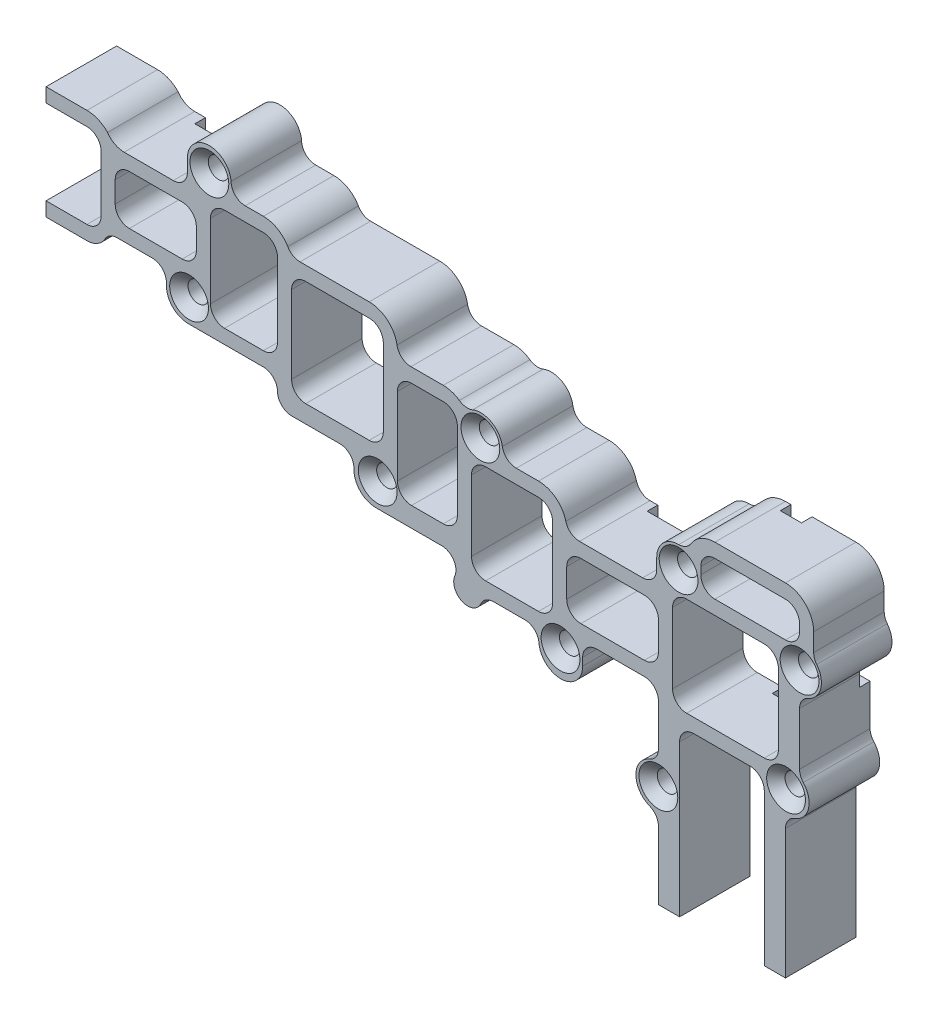
from build123d import *

# Parameters (mm, degrees)
EXTRUDE_1_DEPTH                 = 10
HOLE_WIZARD_M2_51_D             = 2.9
HOLE_WIZARD_M2_51_CSINK_D       = 5.5
HOLE_WIZARD_M2_51_CSINK_ANGLE   = 90
CUT_EXTRUDE_1_REACH             = 117.174
SKETCH_9_W                      = 1.5
SKETCH_9_H                      = 1.8
CUT_EXTRUDE_2_REACH             = 105.395
SKETCH_10_W                     = 1.5
SKETCH_10_H                     = 2.8
CUT_EXTRUDE_3_REACH             = 95.728
SKETCH_11_W                     = 1.5
SKETCH_11_H                     = 4.61050078
CUT_EXTRUDE_5_REACH             = 116.534
SKETCH_12_W                     = 5.79500384
SKETCH_12_H                     = 1.5
CUT_EXTRUDE_6_REACH             = 83.835
SKETCH_13_W                     = 1.5
SKETCH_13_H                     = 5.238699812
CUT_EXTRUDE_6_DIRECTION_2_REACH = 83.835
CUT_EXTRUDE_7_REACH             = 80.99
SKETCH_14_W                     = 1.5
SKETCH_14_H                     = 5.29970024
CUT_EXTRUDE_8_REACH             = 91.419
SKETCH_15_W                     = 1.5
SKETCH_15_H                     = 1.85499896
CUT_EXTRUDE_9_REACH             = 103.857
SKETCH_17_W                     = 1.5
SKETCH_17_H                     = 2.8
CUT_EXTRUDE_10_REACH            = 110.308
SKETCH_18_W                     = 5.78751592
SKETCH_18_H                     = 1.5
CUT_EXTRUDE_11_REACH            = 111.188
SKETCH_19_W                     = 1.80000034
SKETCH_19_H                     = 1.5
CUT_EXTRUDE_12_REACH            = 113.91
SKETCH_20_W                     = 3.00000054
SKETCH_20_H                     = 1.5
CUT_EXTRUDE_13_REACH            = 118.683
SKETCH_21_W                     = 1.5
SKETCH_21_H                     = 2.3400024
CUT_EXTRUDE_14_REACH            = 110.602
SKETCH_22_W                     = 2.8
SKETCH_22_H                     = 1.5


with BuildPart() as part:
    # Эскиз6 → Бобышка-Вытянуть1 (new body)
    with BuildSketch(Plane.XY):
        with BuildLine():
            Line((81.20000086, -9.00000176), (81.20000086, 12.49999824))
            ThreePointArc((81.20000086, 12.49999824), (81.785787298, 13.914211802), (83.20000086, 14.49999824))
            Line((83.20000086, 14.49999824), (91.20000086, 14.49999824))
            ThreePointArc((91.20000086, 14.49999824), (92.614214422, 13.914211802), (93.20000086, 12.49999824))
            Line((93.20000086, 12.49999824), (93.20000086, -9.00000176))
            Line((93.20000086, -9.00000176), (96.20000086, -9.00000176))
            Line((96.20000086, -9.00000176), (96.20000086, 9.366820625))
            ThreePointArc((96.20000086, 9.366820625), (96.561747801, 10.514046373), (97.516127776, 11.246266715))
            ThreePointArc((97.516127776, 11.246266715), (99.468975957, 13.429527292), (98.731814051, 16.264458523))
            ThreePointArc((98.731814051, 16.264458523), (98.337694008, 16.893300305), (98.20000086, 17.622555535))
            Line((98.20000086, 17.622555535), (98.20000086, 25.088270618))
            ThreePointArc((98.20000086, 25.088270618), (98.531374561, 26.190852259), (99.415687135, 26.928067341))
            ThreePointArc((99.415687135, 26.928067341), (101.204160141, 29.014881672), (100.631373409, 31.702881879))
            ThreePointArc((100.631373409, 31.702881879), (100.310919747, 32.286821087), (100.20000086, 32.943610664))
            Line((100.20000086, 32.943610664), (100.20000086, 35.49999824))
            ThreePointArc((100.20000086, 35.49999824), (99.028427985, 38.328425365), (96.20000086, 39.49999824))
            Line((96.20000086, 39.49999824), (86.20000086, 39.49999824))
            ThreePointArc((86.20000086, 39.49999824), (84.24736537, 38.991017381), (82.791656925, 37.593605562))
            ThreePointArc((82.791656925, 37.593605562), (82.058610903, 36.892005839), (81.075597393, 36.640444553))
            ThreePointArc((81.075597393, 36.640444553), (78.871664833, 35.73903516), (77.957171668, 33.540499312))
            Line((77.957171668, 33.540499312), (77.957171668, 31.99999824))
            ThreePointArc((77.957171668, 31.99999824), (77.37138523, 30.585784678), (75.957171668, 29.99999824))
            Line((75.957171668, 29.99999824), (67.009475879, 29.99999824))
            ThreePointArc((67.009475879, 29.99999824), (65.784731008, 30.41885941), (65.072984206, 31.49999824))
            ThreePointArc((65.072984206, 31.49999824), (63.649490603, 33.6622759), (61.20000086, 34.49999824))
            Line((61.20000086, 34.49999824), (58.049746648, 34.49999824))
            ThreePointArc((58.049746648, 34.49999824), (56.752186507, 34.978046309), (56.074922485, 36.183660559))
            ThreePointArc((56.074922485, 36.183660559), (54.543128866, 38.389927001), (51.863412539, 38.571926213))
            ThreePointArc((51.863412539, 38.571926213), (50.895117619, 38.441892277), (49.98075596, 38.786053044))
            ThreePointArc((49.98075596, 38.786053044), (48.894944537, 39.317341506), (47.70000086, 39.49999824))
            Line((47.70000086, 39.49999824), (43.116080643, 39.49999824))
            ThreePointArc((43.116080643, 39.49999824), (41.825086194, 39.972473008), (41.144054049, 41.166664907))
            ThreePointArc((41.144054049, 41.166664907), (39.781989757, 43.555048703), (37.20000086, 44.49999824))
            Line((37.20000086, 44.49999824), (27.396153283, 44.49999824))
            ThreePointArc((27.396153283, 44.49999824), (26.396153283, 44.767947432), (25.664102475, 45.49999824))
            ThreePointArc((25.664102475, 45.49999824), (24.20000086, 46.964099855), (22.20000086, 47.49999824))
            Line((22.20000086, 47.49999824), (19.622055186, 47.49999824))
            ThreePointArc((19.622055186, 47.49999824), (18.208125612, 48.085500746), (17.622055347, 49.49919508))
            ThreePointArc((17.622055347, 49.49919508), (14.407643171, 52.348107474), (11.432038739, 49.250604328))
            Line((11.432038739, 49.250604328), (11.432038739, 47.49999824))
            ThreePointArc((11.432038739, 47.49999824), (10.846252302, 46.085784678), (9.432038739, 45.49999824))
            Line((9.432038739, 45.49999824), (2.472362834, 45.49999824))
            ThreePointArc((2.472362834, 45.49999824), (1.133134911, 45.83192166), (0.10392771, 46.750854261))
            ThreePointArc((0.10392771, 46.750854261), (-1.219401798, 47.674465826), (-2.79999914, 47.99999824))
            Line((-2.79999914, 47.99999824), (-8.59999914, 47.99999824))
            Line((-8.59999914, 47.99999824), (-8.59999914, 45.99999824))
            Line((-8.59999914, 45.99999824), (-2.79999914, 45.99999824))
            ThreePointArc((-2.79999914, 45.99999824), (-1.385785578, 45.414211802), (-0.79999914, 43.99999824))
            Line((-0.79999914, 43.99999824), (-0.79999914, 35.99999824))
            ThreePointArc((-0.79999914, 35.99999824), (-1.385785578, 34.585784678), (-2.79999914, 33.99999824))
            Line((-2.79999914, 33.99999824), (-8.59999914, 33.99999824))
            Line((-8.59999914, 33.99999824), (-8.59999914, 31.99999824))
            Line((-8.59999914, 31.99999824), (-2.79999914, 31.99999824))
            ThreePointArc((-2.79999914, 31.99999824), (-1.32231541, 32.398875435), (-0.246063762, 33.487146823))
            ThreePointArc((-0.246063762, 33.487146823), (0.486938319, 34.228335181), (1.493343515, 34.49999824))
            Line((1.493343515, 34.49999824), (6.460860195, 34.49999824))
            ThreePointArc((6.460860195, 34.49999824), (7.875073757, 33.914211802), (8.460860195, 32.49999824))
            Line((8.460860195, 32.49999824), (8.460860195, 32.09999824))
            ThreePointArc((8.460860195, 32.09999824), (9.368829173, 29.907967218), (11.560860195, 28.99999824))
            Line((11.560860195, 28.99999824), (22.20000086, 28.99999824))
            ThreePointArc((22.20000086, 28.99999824), (23.614214422, 28.414211802), (24.20000086, 26.99999824))
            ThreePointArc((24.20000086, 26.99999824), (24.785787298, 25.585784678), (26.20000086, 24.99999824))
            Line((26.20000086, 24.99999824), (33.041851282, 24.99999824))
            ThreePointArc((33.041851282, 24.99999824), (34.456064844, 24.414211802), (35.041851282, 22.99999824))
            Line((35.041851282, 22.99999824), (35.041851282, 22.79999824))
            ThreePointArc((35.041851282, 22.79999824), (35.94982026, 20.607967218), (38.141851282, 19.69999824))
            Line((38.141851282, 19.69999824), (47.495717397, 19.69999824))
            ThreePointArc((47.495717397, 19.69999824), (49.163112902, 18.804440284), (49.337259097, 16.919790469))
            ThreePointArc((49.337259097, 16.919790469), (50.378754158, 14.306572776), (53.003065225, 15.319790469))
            ThreePointArc((53.003065225, 15.319790469), (53.740955973, 16.179221938), (54.827329652, 16.49999824))
            Line((54.827329652, 16.49999824), (59.273091273, 16.49999824))
            ThreePointArc((59.273091273, 16.49999824), (60.630713184, 15.968624382), (61.266930303, 14.656860985))
            ThreePointArc((61.266930303, 14.656860985), (64.479043159, 11.802386536), (67.4573808, 14.89999824))
            Line((67.4573808, 14.89999824), (67.4573808, 15.99999824))
            ThreePointArc((67.4573808, 15.99999824), (68.043167238, 17.414211802), (69.4573808, 17.99999824))
            Line((69.4573808, 17.99999824), (76.20000086, 17.99999824))
            ThreePointArc((76.20000086, 17.99999824), (77.614214422, 17.414211802), (78.20000086, 15.99999824))
            Line((78.20000086, 15.99999824), (78.20000086, 10.096040906))
            ThreePointArc((78.20000086, 10.096040906), (77.856834599, 8.975816838), (76.945098899, 8.240015876))
            ThreePointArc((76.945098899, 8.240015876), (75.00000086, 5.363177079), (76.945098899, 2.486338283))
            ThreePointArc((76.945098899, 2.486338283), (77.856834599, 1.75053732), (78.20000086, 0.630313253))
            Line((78.20000086, 0.630313253), (78.20000086, -9.00000176))
            Line((78.20000086, -9.00000176), (81.20000086, -9.00000176))
        make_face()
        with BuildLine():
            Line((3.20000086, 43.49999824), (10.70000086, 43.49999824))
            ThreePointArc((10.70000086, 43.49999824), (12.114214422, 42.914211802), (12.70000086, 41.49999824))
            Line((12.70000086, 41.49999824), (12.70000086, 38.49999824))
            ThreePointArc((12.70000086, 38.49999824), (12.114214422, 37.085784678), (10.70000086, 36.49999824))
            Line((10.70000086, 36.49999824), (3.20000086, 36.49999824))
            ThreePointArc((3.20000086, 36.49999824), (1.785787298, 37.085784678), (1.20000086, 38.49999824))
            Line((1.20000086, 38.49999824), (1.20000086, 41.49999824))
            ThreePointArc((1.20000086, 41.49999824), (1.785787298, 42.914211802), (3.20000086, 43.49999824))
        make_face(mode=Mode.SUBTRACT)
        with BuildLine():
            Line((82.20000086, 30.49999824), (93.20000086, 30.49999824))
            ThreePointArc((93.20000086, 30.49999824), (94.614214422, 29.914211802), (95.20000086, 28.49999824))
            Line((95.20000086, 28.49999824), (95.20000086, 18.49999824))
            ThreePointArc((95.20000086, 18.49999824), (94.614214422, 17.085784678), (93.20000086, 16.49999824))
            Line((93.20000086, 16.49999824), (82.20000086, 16.49999824))
            ThreePointArc((82.20000086, 16.49999824), (80.785787298, 17.085784678), (80.20000086, 18.49999824))
            Line((80.20000086, 18.49999824), (80.20000086, 28.49999824))
            ThreePointArc((80.20000086, 28.49999824), (80.785787298, 29.914211802), (82.20000086, 30.49999824))
        make_face(mode=Mode.SUBTRACT)
        with BuildLine():
            Line((86.20000086, 37.49999824), (96.20000086, 37.49999824))
            ThreePointArc((96.20000086, 37.49999824), (97.614214422, 36.914211802), (98.20000086, 35.49999824))
            Line((98.20000086, 35.49999824), (98.20000086, 34.49999824))
            ThreePointArc((98.20000086, 34.49999824), (97.614214422, 33.085784678), (96.20000086, 32.49999824))
            Line((96.20000086, 32.49999824), (86.20000086, 32.49999824))
            ThreePointArc((86.20000086, 32.49999824), (84.785787298, 33.085784678), (84.20000086, 34.49999824))
            Line((84.20000086, 34.49999824), (84.20000086, 35.49999824))
            ThreePointArc((84.20000086, 35.49999824), (84.785787298, 36.914211802), (86.20000086, 37.49999824))
        make_face(mode=Mode.SUBTRACT)
        with BuildLine():
            Line((67.20000086, 27.99999824), (76.20000086, 27.99999824))
            ThreePointArc((76.20000086, 27.99999824), (77.614214422, 27.414211802), (78.20000086, 25.99999824))
            Line((78.20000086, 25.99999824), (78.20000086, 21.99999824))
            ThreePointArc((78.20000086, 21.99999824), (77.614214422, 20.585784678), (76.20000086, 19.99999824))
            Line((76.20000086, 19.99999824), (67.20000086, 19.99999824))
            ThreePointArc((67.20000086, 19.99999824), (65.785787298, 20.585784678), (65.20000086, 21.99999824))
            Line((65.20000086, 21.99999824), (65.20000086, 25.99999824))
            ThreePointArc((65.20000086, 25.99999824), (65.785787298, 27.414211802), (67.20000086, 27.99999824))
        make_face(mode=Mode.SUBTRACT)
        with BuildLine():
            Line((61.20000086, 32.49999824), (53.70000086, 32.49999824))
            ThreePointArc((53.70000086, 32.49999824), (52.285787298, 31.914211802), (51.70000086, 30.49999824))
            Line((51.70000086, 30.49999824), (51.70000086, 20.49999824))
            ThreePointArc((51.70000086, 20.49999824), (52.285787298, 19.085784678), (53.70000086, 18.49999824))
            Line((53.70000086, 18.49999824), (61.20000086, 18.49999824))
            ThreePointArc((61.20000086, 18.49999824), (62.614214422, 19.085784678), (63.20000086, 20.49999824))
            Line((63.20000086, 20.49999824), (63.20000086, 30.49999824))
            ThreePointArc((63.20000086, 30.49999824), (62.614214422, 31.914211802), (61.20000086, 32.49999824))
        make_face(mode=Mode.SUBTRACT)
        with BuildLine():
            Line((43.20000086, 37.49999824), (47.70000086, 37.49999824))
            ThreePointArc((47.70000086, 37.49999824), (49.114214422, 36.914211802), (49.70000086, 35.49999824))
            Line((49.70000086, 35.49999824), (49.70000086, 24.49999824))
            ThreePointArc((49.70000086, 24.49999824), (49.114214422, 23.085784678), (47.70000086, 22.49999824))
            Line((47.70000086, 22.49999824), (43.20000086, 22.49999824))
            ThreePointArc((43.20000086, 22.49999824), (41.785787298, 23.085784678), (41.20000086, 24.49999824))
            Line((41.20000086, 24.49999824), (41.20000086, 35.49999824))
            ThreePointArc((41.20000086, 35.49999824), (41.785787298, 36.914211802), (43.20000086, 37.49999824))
        make_face(mode=Mode.SUBTRACT)
        with BuildLine():
            Line((28.20000086, 42.49999824), (37.20000086, 42.49999824))
            ThreePointArc((37.20000086, 42.49999824), (38.614214422, 41.914211802), (39.20000086, 40.49999824))
            Line((39.20000086, 40.49999824), (39.20000086, 29.49999824))
            ThreePointArc((39.20000086, 29.49999824), (38.614214422, 28.085784678), (37.20000086, 27.49999824))
            Line((37.20000086, 27.49999824), (28.20000086, 27.49999824))
            ThreePointArc((28.20000086, 27.49999824), (26.785787298, 28.085784678), (26.20000086, 29.49999824))
            Line((26.20000086, 29.49999824), (26.20000086, 40.49999824))
            ThreePointArc((26.20000086, 40.49999824), (26.785787298, 41.914211802), (28.20000086, 42.49999824))
        make_face(mode=Mode.SUBTRACT)
        with BuildLine():
            Line((16.70000086, 45.49999824), (22.20000086, 45.49999824))
            ThreePointArc((22.20000086, 45.49999824), (23.614214422, 44.914211802), (24.20000086, 43.49999824))
            Line((24.20000086, 43.49999824), (24.20000086, 32.99999824))
            ThreePointArc((24.20000086, 32.99999824), (23.614214422, 31.585784678), (22.20000086, 30.99999824))
            Line((22.20000086, 30.99999824), (16.70000086, 30.99999824))
            ThreePointArc((16.70000086, 30.99999824), (15.285787298, 31.585784678), (14.70000086, 32.99999824))
            Line((14.70000086, 32.99999824), (14.70000086, 43.49999824))
            ThreePointArc((14.70000086, 43.49999824), (15.285787298, 44.914211802), (16.70000086, 45.49999824))
        make_face(mode=Mode.SUBTRACT)
    extrude(amount=EXTRUDE_1_DEPTH)

    # Отверстие с зазором M2.51 (through all)
    with Locations(Plane.XY.offset(10)):
        with Locations((14.552676738, 48.9918182), (11.673412415, 32.307135082), (38.407901683, 23.093297034), (64.315400785, 15.510970613), (78.189738908, 5.49892165), (96.282490093, 14.234813878), (98.20000086, 29.779752261), (81.057171668, 33.540499312), (52.959520703, 35.665984683)):
            CounterSinkHole(HOLE_WIZARD_M2_51_D / 2, HOLE_WIZARD_M2_51_CSINK_D / 2, counter_sink_angle=HOLE_WIZARD_M2_51_CSINK_ANGLE)

    # Эскиз9 → Вырез-Вытянуть1 (cut, up to next)
    with BuildSketch(Plane.ZY.offset(0.79999914), mode=Mode.PRIVATE) as cut_extrude_1_sk1:
        with Locations((0.75, 39.99999824)):
            Rectangle(SKETCH_9_W, SKETCH_9_H)
    cut_extrude_1_tool1 = extrude(cut_extrude_1_sk1.sketch, amount=-CUT_EXTRUDE_1_REACH, mode=Mode.PRIVATE) & part.part
    add(cut_extrude_1_tool1.solids().sort_by_distance((-0.799999, 39.999998, 0.75))[0], mode=Mode.SUBTRACT)

    # Эскиз10 → Вырез-Вытянуть2 (cut, up to next)
    with BuildSketch(Plane.ZY.offset(-12.70000086), mode=Mode.PRIVATE) as cut_extrude_2_sk1:
        with Locations((0.75, 39.97126499)):
            Rectangle(SKETCH_10_W, SKETCH_10_H)
    cut_extrude_2_tool1 = extrude(cut_extrude_2_sk1.sketch, amount=-CUT_EXTRUDE_2_REACH, mode=Mode.PRIVATE) & part.part
    add(cut_extrude_2_tool1.solids().sort_by_distance((12.700001, 39.971265, 0.75))[0], mode=Mode.SUBTRACT)

    # Эскиз11 → Вырез-Вытянуть3 (cut, up to next)
    with BuildSketch(Plane.ZY.offset(-24.20000086), mode=Mode.PRIVATE) as cut_extrude_3_sk1:
        with Locations((0.75, 36.83914781)):
            Rectangle(SKETCH_11_W, SKETCH_11_H)
    cut_extrude_3_tool1 = extrude(cut_extrude_3_sk1.sketch, amount=-CUT_EXTRUDE_3_REACH, mode=Mode.PRIVATE) & part.part
    add(cut_extrude_3_tool1.solids().sort_by_distance((24.200001, 36.839148, 0.75))[0], mode=Mode.SUBTRACT)

    # Эскиз12 → Вырез-Вытянуть5 (cut, up to next)
    with BuildSketch(Plane.XZ.offset(-43.49999824), mode=Mode.PRIVATE) as cut_extrude_5_sk1:
        with Locations((6.88750972, 0.75)):
            Rectangle(SKETCH_12_W, SKETCH_12_H)
    cut_extrude_5_tool1 = extrude(cut_extrude_5_sk1.sketch, amount=-CUT_EXTRUDE_5_REACH, mode=Mode.PRIVATE) & part.part
    add(cut_extrude_5_tool1.solids().sort_by_distance((6.88751, 43.499998, 0.75))[0], mode=Mode.SUBTRACT)

    # Эскиз13 → Вырез-Вытянуть6 (cut, up to next)
    with BuildSketch(Plane.ZY.offset(-39.20000086), mode=Mode.PRIVATE) as cut_extrude_6_sk1:
        with Locations((0.75, 31.850348174)):
            Rectangle(SKETCH_13_W, SKETCH_13_H)
    cut_extrude_6_tool1 = extrude(cut_extrude_6_sk1.sketch, amount=-CUT_EXTRUDE_6_REACH, mode=Mode.PRIVATE) & part.part
    add(cut_extrude_6_tool1.solids().sort_by_distance((39.200001, 31.850348, 0.75))[0], mode=Mode.SUBTRACT)

    # Эскиз13 → Вырез-Вытянуть6 direction 2 (cut, up to next)
    with BuildSketch(Plane.ZY.offset(-39.20000086), mode=Mode.PRIVATE) as cut_extrude_6_direction_2_sk1:
        with Locations((0.75, 31.850348174)):
            Rectangle(SKETCH_13_W, SKETCH_13_H)
    cut_extrude_6_direction_2_tool1 = extrude(cut_extrude_6_direction_2_sk1.sketch, amount=CUT_EXTRUDE_6_DIRECTION_2_REACH, mode=Mode.PRIVATE) & part.part
    add(cut_extrude_6_direction_2_tool1.solids().sort_by_distance((39.200001, 31.850348, 0.75))[0], mode=Mode.SUBTRACT)

    # Эскиз14 → Вырез-Вытянуть7 (cut, up to next)
    with BuildSketch(Plane.ZY.offset(-49.70000086), mode=Mode.PRIVATE) as cut_extrude_7_sk1:
        with Locations((0.75, 28.40014974)):
            Rectangle(SKETCH_14_W, SKETCH_14_H)
    cut_extrude_7_tool1 = extrude(cut_extrude_7_sk1.sketch, amount=-CUT_EXTRUDE_7_REACH, mode=Mode.PRIVATE) & part.part
    add(cut_extrude_7_tool1.solids().sort_by_distance((49.700001, 28.40015, 0.75))[0], mode=Mode.SUBTRACT)

    # Эскиз15 → Вырез-Вытянуть8 (cut, up to next)
    with BuildSketch(Plane.ZY.offset(-63.20000086), mode=Mode.PRIVATE) as cut_extrude_8_sk1:
        with Locations((0.75, 23.84999802)):
            Rectangle(SKETCH_15_W, SKETCH_15_H)
    cut_extrude_8_tool1 = extrude(cut_extrude_8_sk1.sketch, amount=-CUT_EXTRUDE_8_REACH, mode=Mode.PRIVATE) & part.part
    add(cut_extrude_8_tool1.solids().sort_by_distance((63.200001, 23.849998, 0.75))[0], mode=Mode.SUBTRACT)

    # Эскиз17 → Вырез-Вытянуть9 (cut, up to next)
    with BuildSketch(Plane.ZY.offset(-78.20000086), mode=Mode.PRIVATE) as cut_extrude_9_sk1:
        with Locations((0.75, 23.842142839)):
            Rectangle(SKETCH_17_W, SKETCH_17_H)
    cut_extrude_9_tool1 = extrude(cut_extrude_9_sk1.sketch, amount=-CUT_EXTRUDE_9_REACH, mode=Mode.PRIVATE) & part.part
    add(cut_extrude_9_tool1.solids().sort_by_distance((78.200001, 23.842143, 0.75))[0], mode=Mode.SUBTRACT)

    # Эскиз18 → Вырез-Вытянуть10 (cut, up to next)
    with BuildSketch(Plane.XZ.offset(-27.99999824), mode=Mode.PRIVATE) as cut_extrude_10_sk1:
        with Locations((71.0000104, 0.75)):
            Rectangle(SKETCH_18_W, SKETCH_18_H)
    cut_extrude_10_tool1 = extrude(cut_extrude_10_sk1.sketch, amount=-CUT_EXTRUDE_10_REACH, mode=Mode.PRIVATE) & part.part
    add(cut_extrude_10_tool1.solids().sort_by_distance((71.00001, 27.999998, 0.75))[0], mode=Mode.SUBTRACT)

    # Эскиз19 → Вырез-Вытянуть11 (cut, up to next)
    with BuildSketch(Plane(origin=(0, 30.49999824, 0), x_dir=(-1, 0, 0), z_dir=(0, -1, 0)), mode=Mode.PRIVATE) as cut_extrude_11_sk1:
        with Locations((-87.97488374, -0.75)):
            Rectangle(SKETCH_19_W, SKETCH_19_H)
    cut_extrude_11_tool1 = extrude(cut_extrude_11_sk1.sketch, amount=-CUT_EXTRUDE_11_REACH, mode=Mode.PRIVATE) & part.part
    add(cut_extrude_11_tool1.solids().sort_by_distance((87.974884, 30.499998, 0.75))[0], mode=Mode.SUBTRACT)

    # Эскиз20 → Вырез-Вытянуть12 (cut, up to next)
    with BuildSketch(Plane.XZ.offset(-37.49999824), mode=Mode.PRIVATE) as cut_extrude_12_sk1:
        with Locations((88.47488655, 0.75)):
            Rectangle(SKETCH_20_W, SKETCH_20_H)
    cut_extrude_12_tool1 = extrude(cut_extrude_12_sk1.sketch, amount=-CUT_EXTRUDE_12_REACH, mode=Mode.PRIVATE) & part.part
    add(cut_extrude_12_tool1.solids().sort_by_distance((88.474887, 37.499998, 0.75))[0], mode=Mode.SUBTRACT)

    # Эскиз21 → Вырез-Вытянуть13 (cut, up to next)
    with BuildSketch(Plane.ZY.offset(-95.20000086), mode=Mode.PRIVATE) as cut_extrude_13_sk1:
        with Locations((0.75, 24.59999906)):
            Rectangle(SKETCH_21_W, SKETCH_21_H)
    cut_extrude_13_tool1 = extrude(cut_extrude_13_sk1.sketch, amount=-CUT_EXTRUDE_13_REACH, mode=Mode.PRIVATE) & part.part
    add(cut_extrude_13_tool1.solids().sort_by_distance((95.200001, 24.599999, 0.75))[0], mode=Mode.SUBTRACT)

    # Эскиз22 → Вырез-Вытянуть14 (cut, up to next)
    with BuildSketch(Plane.XZ.offset(-14.49999824), mode=Mode.PRIVATE) as cut_extrude_14_sk1:
        with Locations((87.238335762, 0.75)):
            Rectangle(SKETCH_22_W, SKETCH_22_H)
    cut_extrude_14_tool1 = extrude(cut_extrude_14_sk1.sketch, amount=-CUT_EXTRUDE_14_REACH, mode=Mode.PRIVATE) & part.part
    add(cut_extrude_14_tool1.solids().sort_by_distance((87.238336, 14.499998, 0.75))[0], mode=Mode.SUBTRACT)


solid = part.part
